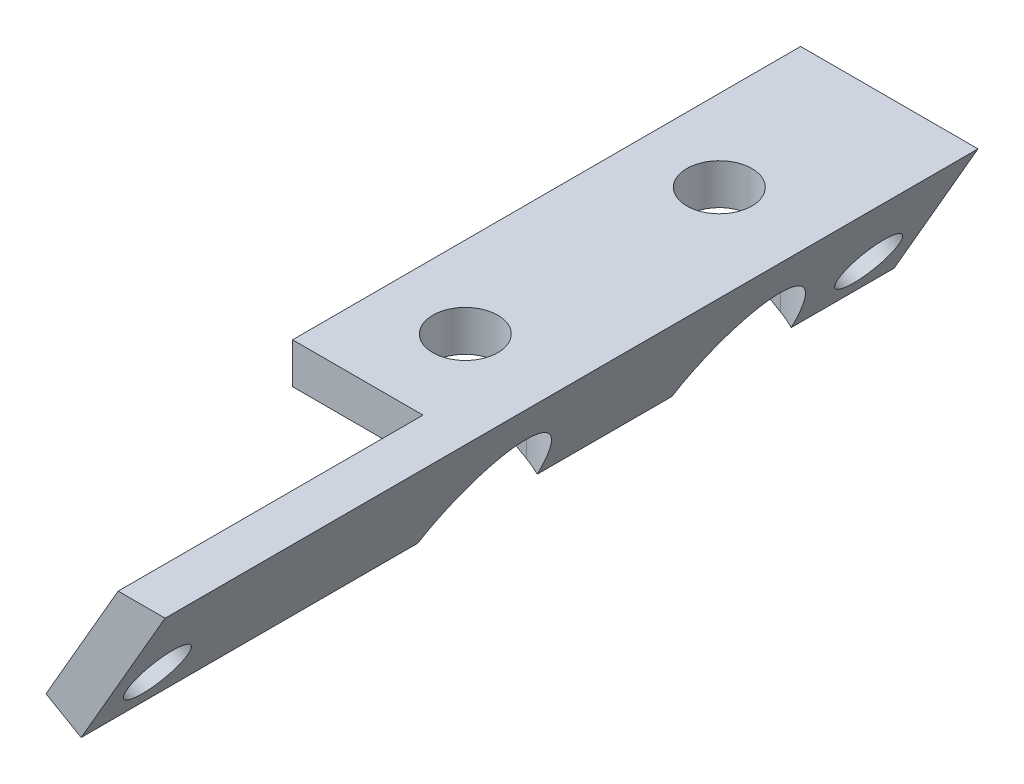
from build123d import *

# Parameters (mm, degrees)
BOSS_EXTRUDE1_DEPTH = 25
BOSS_EXTRUDE2_DEPTH = 15
CUT_EXTRUDE1_REACH  = 42.894
SKETCH3_R           = 1.5
CUT_EXTRUDE2_REACH  = 42.894
SKETCH4_R           = 1.6
CUT_EXTRUDE3_DEPTH  = 41.591655546


with BuildPart() as part:
    # Sketch1 → Boss-Extrude1 (new body)
    with BuildSketch(Plane.XY):
        Polygon((0, 0), (4.128054425, 7.15), (-4.6, 7.15), (-4.6, 5.15), (0.66395281, 5.15), (-1.732050808, 1), align=None)
    extrude(amount=BOSS_EXTRUDE1_DEPTH)

    # Sketch2 → Boss-Extrude2 (add)
    with BuildSketch(Plane.XY.offset(25)):
        Polygon((4.128054425, 7.15), (0, 0), (-1.732050808, 1), (1.818653348, 7.15), align=None)
    extrude(amount=BOSS_EXTRUDE2_DEPTH)

    # Sketch3 → Cut-Extrude1 (cut, up to next)
    with BuildSketch(Plane(origin=(0, 0, 0), x_dir=(0, 0, -1), z_dir=(0.8660254037844365, -0.5000000000000039, 0)), mode=Mode.PRIVATE) as cut_extrude1_sk1:
        with Locations(Location((-37.5, 2.5, 0), (0, 0, 90))):
            Circle(SKETCH3_R)
    cut_extrude1_tool1 = extrude(cut_extrude1_sk1.sketch, amount=-CUT_EXTRUDE1_REACH, mode=Mode.PRIVATE) & part.part
    # Sketch3 → Cut-Extrude1 (cut, up to next)
    with BuildSketch(Plane(origin=(0, 0, 0), x_dir=(0, 0, -1), z_dir=(0.8660254037844365, -0.5000000000000039, 0)), mode=Mode.PRIVATE) as cut_extrude1_sk2:
        with Locations(Location((-2.5, 2.5, 0), (0, 0, 90))):
            Circle(SKETCH3_R)
    cut_extrude1_tool2 = extrude(cut_extrude1_sk2.sketch, amount=-CUT_EXTRUDE1_REACH, mode=Mode.PRIVATE) & part.part
    add(cut_extrude1_tool1.solids().sort_by_distance((1.25, 2.165064, 37.5))[0], mode=Mode.SUBTRACT)
    add(cut_extrude1_tool2.solids().sort_by_distance((1.25, 2.165064, 2.5))[0], mode=Mode.SUBTRACT)

    # Sketch4 → Cut-Extrude2 (cut, up to next)
    with BuildSketch(Plane(origin=(0, 7.15, 0), x_dir=(1, 0, 0), z_dir=(0, 1, 0)), mode=Mode.PRIVATE) as cut_extrude2_sk1:
        with Locations(Location((-0.6, -8, 0), (0, 0, 180))):
            Circle(SKETCH4_R)
    cut_extrude2_tool1 = extrude(cut_extrude2_sk1.sketch, amount=-CUT_EXTRUDE2_REACH, mode=Mode.PRIVATE) & part.part
    # Sketch4 → Cut-Extrude2 (cut, up to next)
    with BuildSketch(Plane(origin=(0, 7.15, 0), x_dir=(1, 0, 0), z_dir=(0, 1, 0)), mode=Mode.PRIVATE) as cut_extrude2_sk2:
        with Locations(Location((-0.6, -20.5, 0), (0, 0, 180))):
            Circle(SKETCH4_R)
    cut_extrude2_tool2 = extrude(cut_extrude2_sk2.sketch, amount=-CUT_EXTRUDE2_REACH, mode=Mode.PRIVATE) & part.part
    add(cut_extrude2_tool1.solids().sort_by_distance((-0.6, 7.15, 8))[0], mode=Mode.SUBTRACT)
    add(cut_extrude2_tool2.solids().sort_by_distance((-0.6, 7.15, 20.5))[0], mode=Mode.SUBTRACT)

    # Sketch5 → Cut-Extrude3 (cut, through all)
    with BuildSketch(Plane.XZ.offset(-5.15)):
        with BuildLine():
            Line((-0.6, 23.5), (-3.6, 23.5))
            Line((-3.6, 23.5), (-3.6, 17.5))
            Line((-3.6, 17.5), (-0.6, 17.5))
            ThreePointArc((-0.6, 17.5), (2.4, 20.5), (-0.6, 23.5))
        make_face()
        with BuildLine():
            Line((-0.6, 11), (-3.6, 11))
            Line((-3.6, 11), (-3.6, 5))
            Line((-3.6, 5), (-0.6, 5))
            ThreePointArc((-0.6, 5), (2.4, 8), (-0.6, 11))
        make_face()
    extrude(amount=CUT_EXTRUDE3_DEPTH, mode=Mode.SUBTRACT)


solid = part.part
